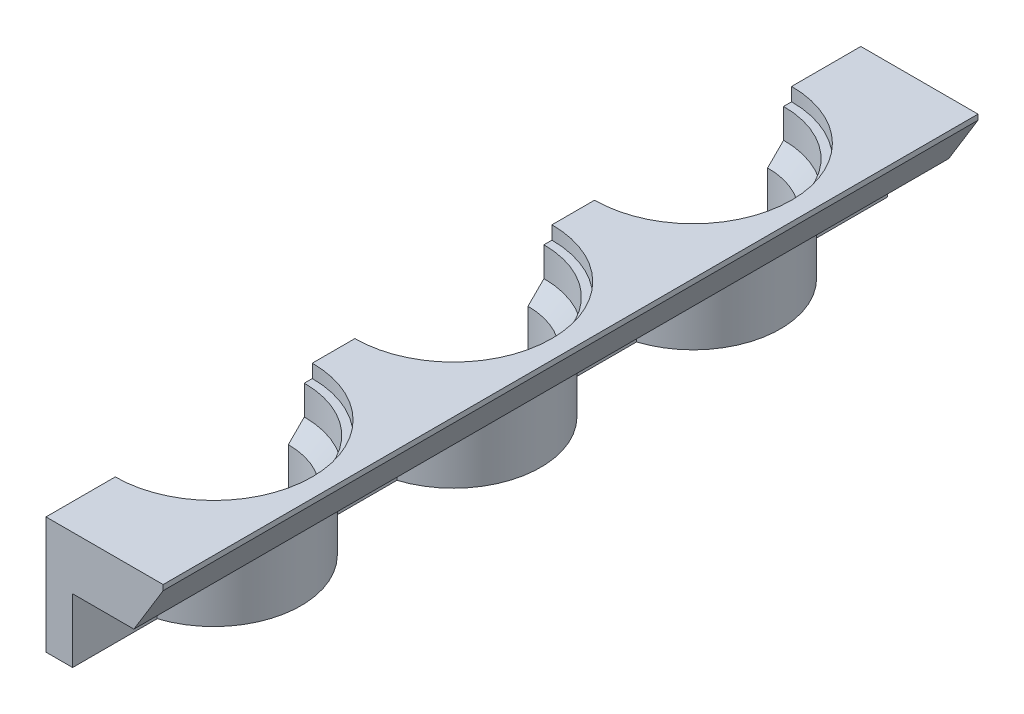
from build123d import *

# Parameters (mm, degrees)
BOSS_EXTRUDE1_DEPTH = 10
BOSS_EXTRUDE2_DEPTH = 12
CHAMFER2_SIZE       = 5.5
CHAMFER2_SIZE2      = 9
SKETCH6_W           = 14
SKETCH6_H           = 15
SKETCH6_W_2         = 17
SKETCH6_H_2         = 2.5
SKETCH6_W_3         = 1.5
LPATTERN3_COUNT     = 3
LPATTERN3_PITCH     = 45
SKETCH7_R           = 1.5
CUT_EXTRUDE1_DEPTH  = 10
LPATTERN4_COUNT     = 3
LPATTERN4_PITCH     = 45
LPATTERN5_COUNT     = 2
LPATTERN5_PITCH     = 45


with BuildPart() as part:
    # Sketch1 → Boss-Extrude1 (new body)
    with BuildSketch(Plane(origin=(0, 0, 0), x_dir=(1, 0, 0), z_dir=(0, 1, 0))):
        with BuildLine():
            Line((0, -11.4), (0, -31.5))
            Line((0, -31.5), (22, -31.5))
            Line((22, -31.5), (22, 121.5))
            Line((22, 121.5), (0, 121.5))
            Line((0, 121.5), (0, 101.4))
            ThreePointArc((0, 101.4), (11.4, 90), (0, 78.6))
            Line((0, 78.6), (0, 56.4))
            ThreePointArc((0, 56.4), (11.4, 45), (0, 33.6))
            Line((0, 33.6), (0, 11.4))
            ThreePointArc((0, 11.4), (11.4, 0), (0, -11.4))
        make_face()
    extrude(amount=-BOSS_EXTRUDE1_DEPTH)

    # Sketch3 → Boss-Extrude2 (add)
    with BuildSketch(Plane.XZ.offset(10)):
        with BuildLine():
            Line((0, -121.5), (0, -101.4))
            ThreePointArc((0, -101.4), (11.4, -90), (0, -78.6))
            Line((0, -78.6), (0, -56.4))
            ThreePointArc((0, -56.4), (11.4, -45), (0, -33.6))
            Line((0, -33.6), (0, -11.4))
            ThreePointArc((0, -11.4), (11.4, 0), (0, 11.4))
            Line((0, 11.4), (0, 31.5))
            Line((0, 31.5), (5, 31.5))
            Line((5, 31.5), (5, 15.619218931))
            ThreePointArc((5, 15.619218931), (16.4, 0), (5, -15.619218931))
            Line((5, -15.619218931), (5, -29.380781069))
            ThreePointArc((5, -29.380781069), (16.4, -45), (5, -60.619218931))
            Line((5, -60.619218931), (5, -74.380781069))
            ThreePointArc((5, -74.380781069), (16.4, -90), (5, -105.619218931))
            Line((5, -105.619218931), (5, -121.5))
            Line((5, -121.5), (0, -121.5))
        make_face()
    extrude(amount=BOSS_EXTRUDE2_DEPTH)

    # Chamfer2
    chamfer2_edges = [part.edges().sort_by_distance(p)[0] for p in [
        (22, -10, -45),
    ]]
    chamfer2_side = [part.faces().sort_by_distance(p)[0] for p in [
        (6.539415473, -10, 23.559609465),
    ]]
    chamfer(chamfer2_edges, length=CHAMFER2_SIZE, length2=CHAMFER2_SIZE2, reference=chamfer2_side[0])

    # Sketch6 → Cut-Revolve6 (revolve, cut)
    with BuildSketch(Plane.ZY):
        with Locations((-83, -18.5)):
            Rectangle(SKETCH6_W, SKETCH6_H)
        Polygon((-90, -11), (-76, -11), (-73, -8), (-73, -2.5), (-90, -2.5), align=None)
        with Locations((-81.5, -1.25)):
            Rectangle(SKETCH6_W_2, SKETCH6_H_2)
        with Locations((-72.25, -1.25)):
            Rectangle(SKETCH6_W_3, SKETCH6_H_2)
    cut_revolve6 = revolve(axis=Axis((0, 0, -90), (0, -1, 0)), mode=Mode.SUBTRACT)

    # LPattern3: Cut-Revolve6 ×3
    with Locations(*[(0, 0, i * LPATTERN3_PITCH) for i in range(1, LPATTERN3_COUNT)]):
        add(cut_revolve6, mode=Mode.SUBTRACT)

    # Sketch7 → Cut-Extrude1 (cut)
    with BuildSketch(Plane(origin=(5, 0, 0), x_dir=(0, 0, -1), z_dir=(1, 0, 0))):
        with Locations((67.5, -13)):
            Circle(SKETCH7_R)
    cut_extrude1 = extrude(amount=-CUT_EXTRUDE1_DEPTH, mode=Mode.SUBTRACT)

    # LPattern4: Cut-Extrude1 ×3
    with Locations(*[(0, 0, i * LPATTERN4_PITCH) for i in range(1, LPATTERN4_COUNT)]):
        add(cut_extrude1, mode=Mode.SUBTRACT)

    # LPattern5: Cut-Extrude1 ×2
    with Locations(*[(0, 0, -i * LPATTERN5_PITCH) for i in range(1, LPATTERN5_COUNT)]):
        add(cut_extrude1, mode=Mode.SUBTRACT)


solid = part.part
